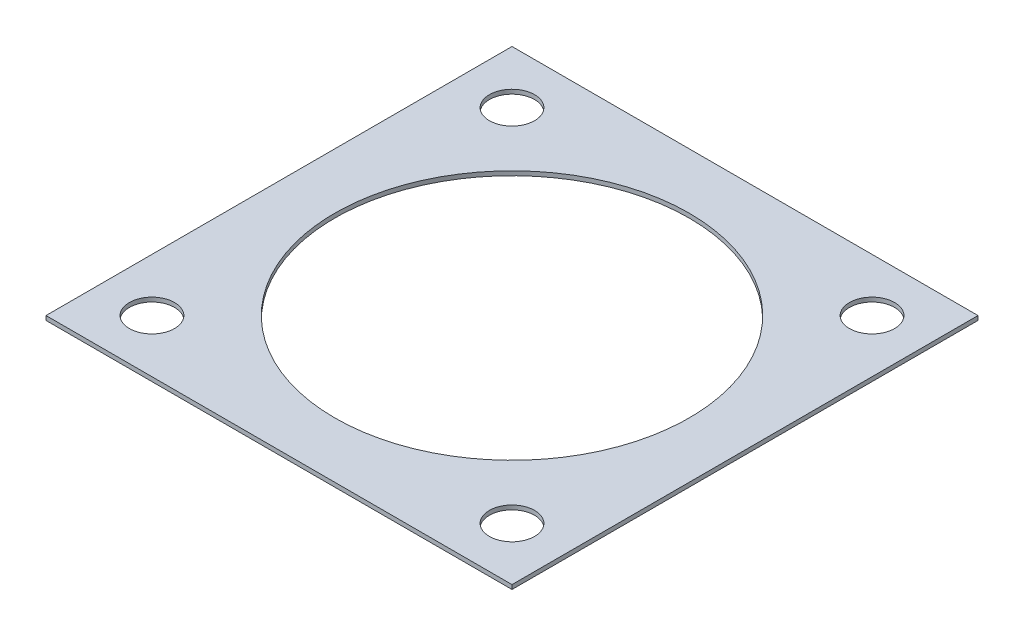
from build123d import *

# Parameters (mm, degrees)
SKETCH1_W           = 109.022628276
SKETCH1_H           = 109.022628276
SKETCH1_R           = 41.477555821
SKETCH1_R_2         = 5.280963553
BOSS_EXTRUDE1_DEPTH = 1


with BuildPart() as part:
    # Sketch1 → Boss-Extrude1 (new body)
    with BuildSketch(Plane(origin=(0, 0, 0), x_dir=(1, 0, 0), z_dir=(0, 1, 0))):
        Rectangle(SKETCH1_W, SKETCH1_H)
        with Locations(Location((0, 0, 0), (0, 0, 270))):
            Circle(SKETCH1_R, mode=Mode.SUBTRACT)
        with Locations(Location((42.116320947, 42.116320947, 0), (0, 0, 270))):
            Circle(SKETCH1_R_2, mode=Mode.SUBTRACT)
        with Locations(Location((42.116320947, -42.116320947, 0), (0, 0, 270))):
            Circle(SKETCH1_R_2, mode=Mode.SUBTRACT)
        with Locations(Location((-42.116320947, -42.116320947, 0), (0, 0, 270))):
            Circle(SKETCH1_R_2, mode=Mode.SUBTRACT)
        with Locations(Location((-42.116320947, 42.116320947, 0), (0, 0, 270))):
            Circle(SKETCH1_R_2, mode=Mode.SUBTRACT)
    extrude(amount=BOSS_EXTRUDE1_DEPTH)


solid = part.part
